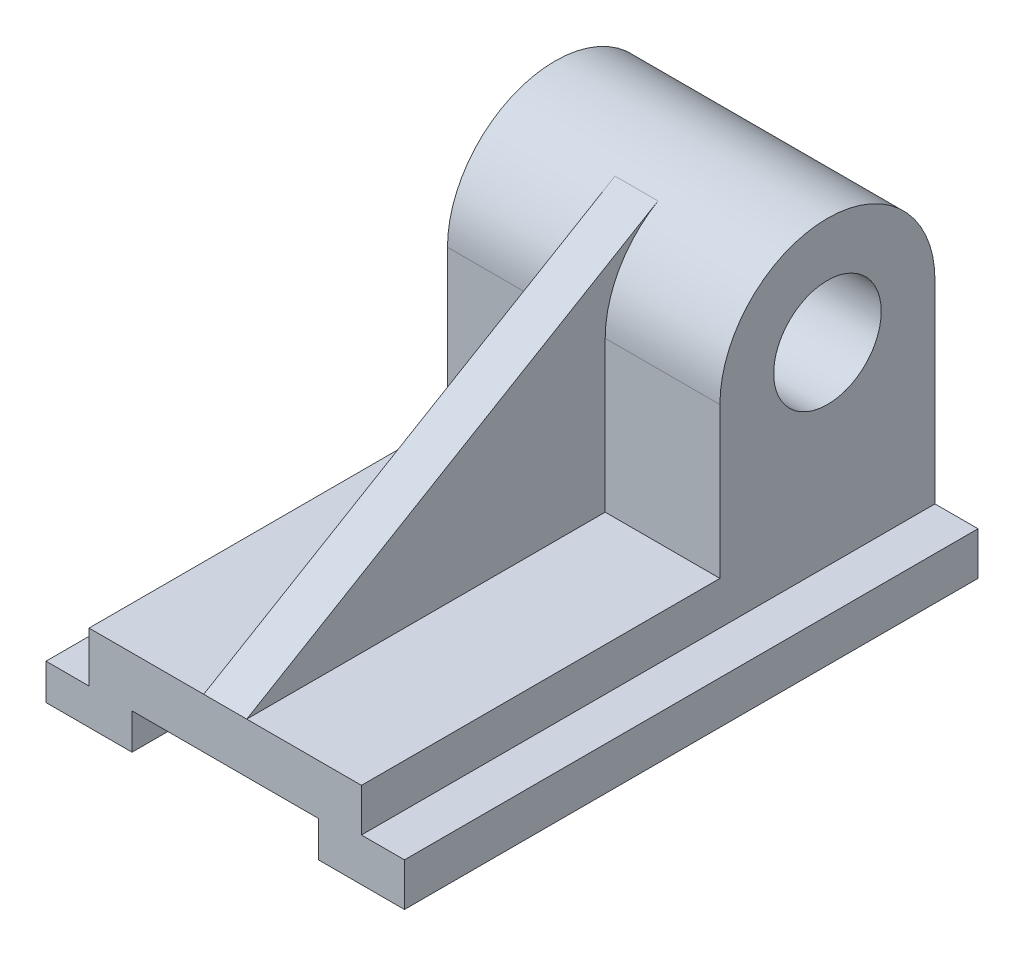
from build123d import *

# Parameters (mm, degrees)
BOSS_EXTRUDE1_DEPTH = 160
BOSS_EXTRUDE2_START = -12
SKETCH2_W           = 60
SKETCH2_H           = 72
BOSS_EXTRUDE2_DEPTH = 76
FILLET1_RADIUS      = 30
FILLET1_LENGTH      = 76
SKETCH3_R           = 15
CUT_EXTRUDE1_DEPTH  = 76
RIB1_REACH          = 190.404
SKETCH4_WALL_W      = 512.089299886
SKETCH4_WALL_H      = 12


with BuildPart() as part:
    # Sketch1 → Boss-Extrude1 (new body)
    with BuildSketch(Plane.XY):
        Polygon((26, 0), (-26, 0), (-26, -10), (-50, -10), (-50, 0), (-38, 0), (-38, 14), (38, 14), (38, 2), (50, 2), (50, -10), (26, -10), align=None)
    extrude(amount=BOSS_EXTRUDE1_DEPTH)

    # Sketch2 → Boss-Extrude2 (add)
    with BuildSketch(Plane(origin=(50, 0, 0), x_dir=(0, 0, -1), z_dir=(1, 0, 0)).offset(BOSS_EXTRUDE2_START)):
        with Locations((-30, 50)):
            Rectangle(SKETCH2_W, SKETCH2_H)
    extrude(amount=-BOSS_EXTRUDE2_DEPTH)

    # Fillet1: full round fillet: the end face becomes a half cylinder, R = half its width
    fillet1_face = Plane((0, 86, 30), x_dir=(1, 0, 0), z_dir=(0, 1, 0))  # on the end face: x along it, z out of the body
    fillet1_slab = fillet1_face.offset(-FILLET1_RADIUS / 2) * Box(FILLET1_LENGTH, 2 * FILLET1_RADIUS, FILLET1_RADIUS, mode=Mode.PRIVATE)  # the body's end, R deep
    fillet1_round = Plane((0, 56, 30), x_dir=(0, 1, 0), z_dir=(1, 0, 0)) * Cylinder(FILLET1_RADIUS, FILLET1_LENGTH, mode=Mode.PRIVATE)  # its axis R under the face
    add(fillet1_slab - fillet1_round, mode=Mode.SUBTRACT)

    # Sketch3 → Cut-Extrude1 (cut)
    with BuildSketch(Plane(origin=(38, 0, 0), x_dir=(0, 0, -1), z_dir=(1, 0, 0))):
        with Locations((-30, 56)):
            Circle(SKETCH3_R)
    extrude(amount=-CUT_EXTRUDE1_DEPTH, mode=Mode.SUBTRACT)

    # Sketch4 wall → Rib1 (add, up to next)
    with BuildSketch(Plane(origin=(0, 47.912517706, 102.633274951), x_dir=(0, -0.508884996756, 0.860834513758), z_dir=(0, -0.860834513758, -0.508884996756)), mode=Mode.PRIVATE) as rib1_sk1:
        Rectangle(SKETCH4_WALL_W, SKETCH4_WALL_H)
    rib1_tool1 = extrude(rib1_sk1.sketch, amount=RIB1_REACH, mode=Mode.PRIVATE) - part.part
    add(rib1_tool1.solids().sort_by_distance((0, 47.912517706, 102.633274951))[0])


solid = part.part
